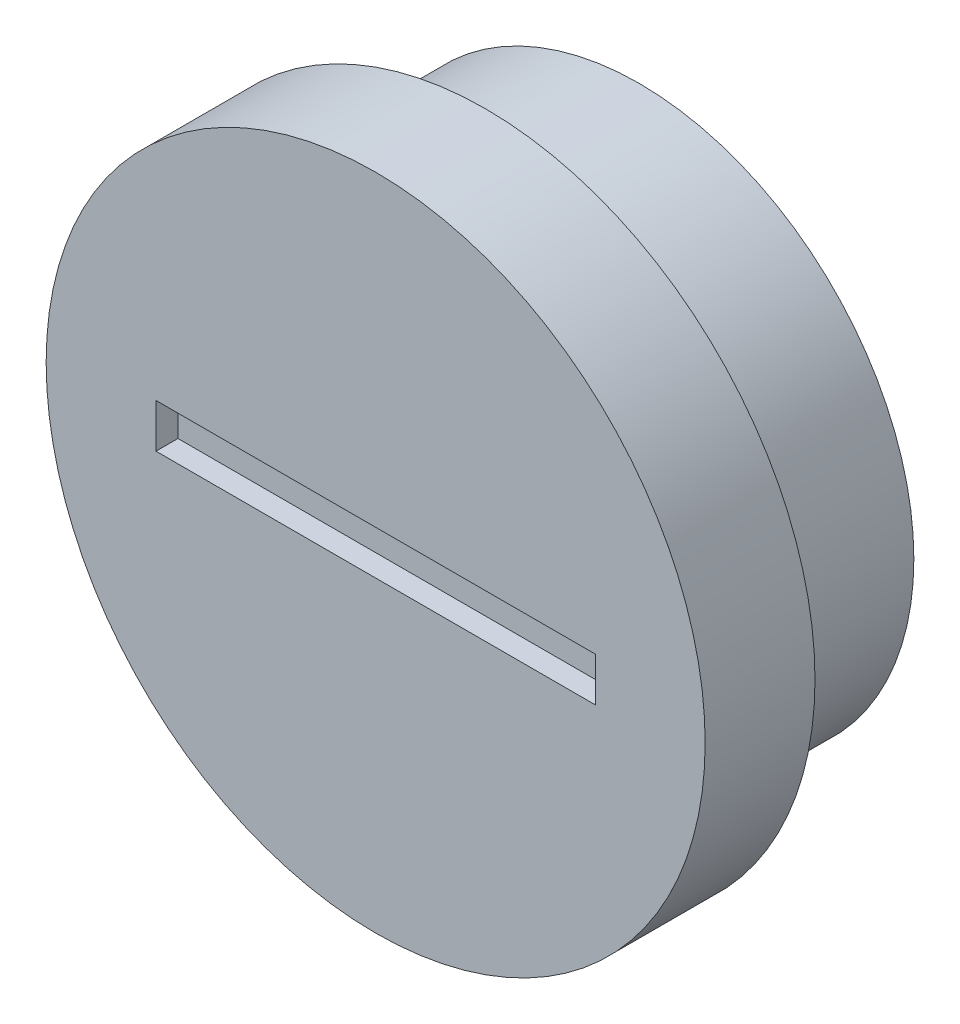
from build123d import *

# Parameters (mm, degrees)
SKETCH_1_R          = 12.5
SKETCH_1_R_2        = 10.65
EXTRUDE_1_DEPTH     = 7
SKETCH_2_R          = 15
EXTRUDE_2_DEPTH     = 5
SKETCH_4_R          = 9
EXTRUDE_3_DEPTH     = 7.5
SKETCH_5_W          = 20
SKETCH_5_H          = 2
CUT_EXTRUDE_1_DEPTH = 1
SKETCH_6_W          = 5
SKETCH_6_H          = 2
CUT_EXTRUDE_2_DEPTH = 3


with BuildPart() as part:
    # 스케치1 → 보스-돌출1 (new body)
    with BuildSketch(Plane.XY):
        Circle(SKETCH_1_R)
        Circle(SKETCH_1_R_2, mode=Mode.SUBTRACT)
    extrude(amount=EXTRUDE_1_DEPTH)

    # 스케치2 → 보스-돌출2 (add)
    with BuildSketch(Plane.XY.offset(7)):
        Circle(SKETCH_2_R)
    extrude(amount=EXTRUDE_2_DEPTH)

    # 스케치4 → 보스-돌출3 (add)
    with BuildSketch(Plane(origin=(0, 0, 7), x_dir=(-1, 0, 0), z_dir=(0, 0, -1))):
        with Locations(Location((0, 0, 0), (0, 0, 180))):
            Circle(SKETCH_4_R)
    extrude(amount=EXTRUDE_3_DEPTH)

    # 스케치5 → 컷-돌출1 (cut)
    with BuildSketch(Plane.XY.offset(12)):
        Rectangle(SKETCH_5_W, SKETCH_5_H)
    extrude(amount=-CUT_EXTRUDE_1_DEPTH, mode=Mode.SUBTRACT)

    # 스케치6 → 컷-돌출2 (cut)
    with BuildSketch(Plane(origin=(0, 0, -0.5), x_dir=(-1, 0, 0), z_dir=(0, 0, -1))):
        with Locations((0, 1)):
            Rectangle(SKETCH_6_W, SKETCH_6_H)
    extrude(amount=-CUT_EXTRUDE_2_DEPTH, mode=Mode.SUBTRACT)


solid = part.part
